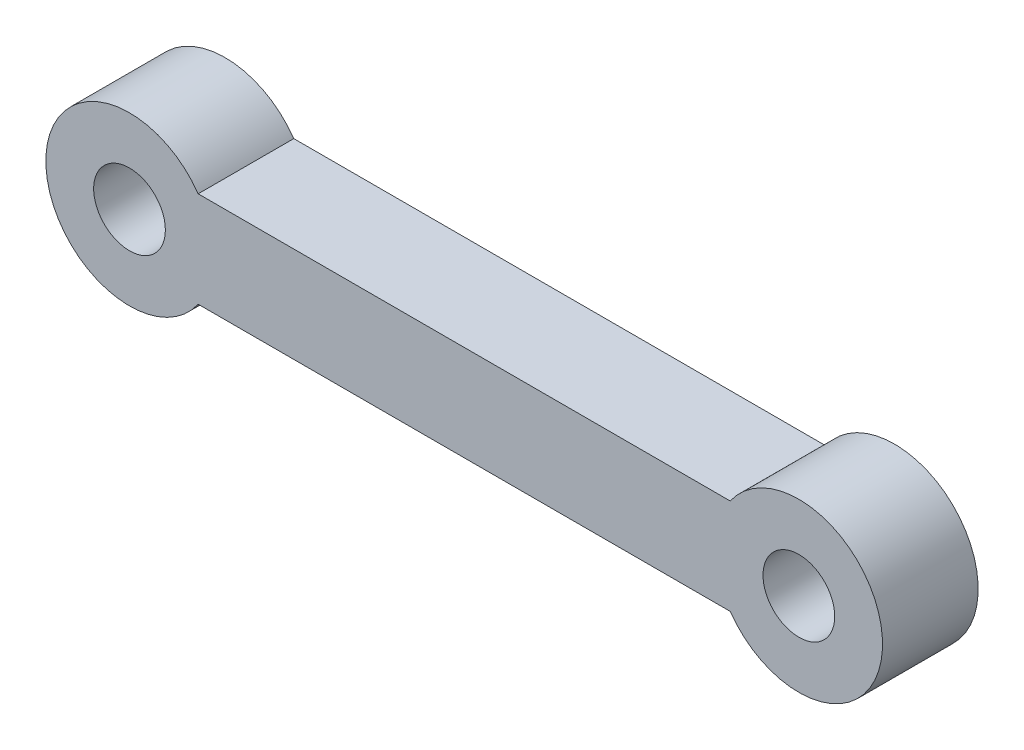
from build123d import *

# Parameters (mm, degrees)
SKETCH1_R           = 7.5
BOSS_EXTRUDE2_DEPTH = 20


with BuildPart() as part:
    # Sketch1 → Boss-Extrude2 (new body)
    # profile 1 of 5: a face of its own
    with BuildSketch(Plane.XY):
        with BuildLine():
            ThreePointArc((7.5, 10), (6.696925103, 4.759514134), (4.361406616, 0))
            Line((4.361406616, 0), (115.638593384, 0))
            ThreePointArc((115.638593384, 0), (112.5, 10), (115.638593384, 20))
            Line((115.638593384, 20), (4.361406616, 20))
            ThreePointArc((4.361406616, 20), (6.696925103, 15.240485866), (7.5, 10))
        make_face()
    # profile 2 of 5: a face of its own
    with BuildSketch(Plane.XY):
        with BuildLine():
            Line((0, 20), (0, 0))
            Line((0, 0), (4.361406616, 0))
            ThreePointArc((4.361406616, 0), (6.696925103, 4.759514134), (7.5, 10))
            ThreePointArc((7.5, 10), (6.696925103, 15.240485866), (4.361406616, 20))
            Line((4.361406616, 20), (0, 20))
        make_face()
    # profile 3 of 5: a face of its own
    with BuildSketch(Plane.XY):
        with BuildLine():
            ThreePointArc((115.638593384, 20), (112.5, 10), (115.638593384, 0))
            Line((115.638593384, 0), (120, 0))
            Line((120, 0), (120, 20))
            Line((120, 20), (115.638593384, 20))
        make_face()
    # profile 4 of 5: a face of its own
    with BuildSketch(Plane.XY):
        with BuildLine():
            Line((120, 0), (115.638593384, 0))
            ThreePointArc((115.638593384, 0), (135.240485866, -6.696925103), (147.5, 10))
            ThreePointArc((147.5, 10), (135.240485866, 26.696925103), (115.638593384, 20))
            Line((115.638593384, 20), (120, 20))
            Line((120, 20), (120, 0))
        make_face()
        with Locations((130, 10)):
            Circle(SKETCH1_R, mode=Mode.SUBTRACT)
    # profile 5 of 5: a face of its own
    with BuildSketch(Plane.XY):
        with BuildLine():
            Line((4.361406616, 0), (0, 0))
            Line((0, 0), (0, 20))
            Line((0, 20), (4.361406616, 20))
            ThreePointArc((4.361406616, 20), (-27.5, 10), (4.361406616, 0))
        make_face()
        with Locations((-10, 10)):
            Circle(SKETCH1_R, mode=Mode.SUBTRACT)
    extrude(amount=BOSS_EXTRUDE2_DEPTH)


solid = part.part
